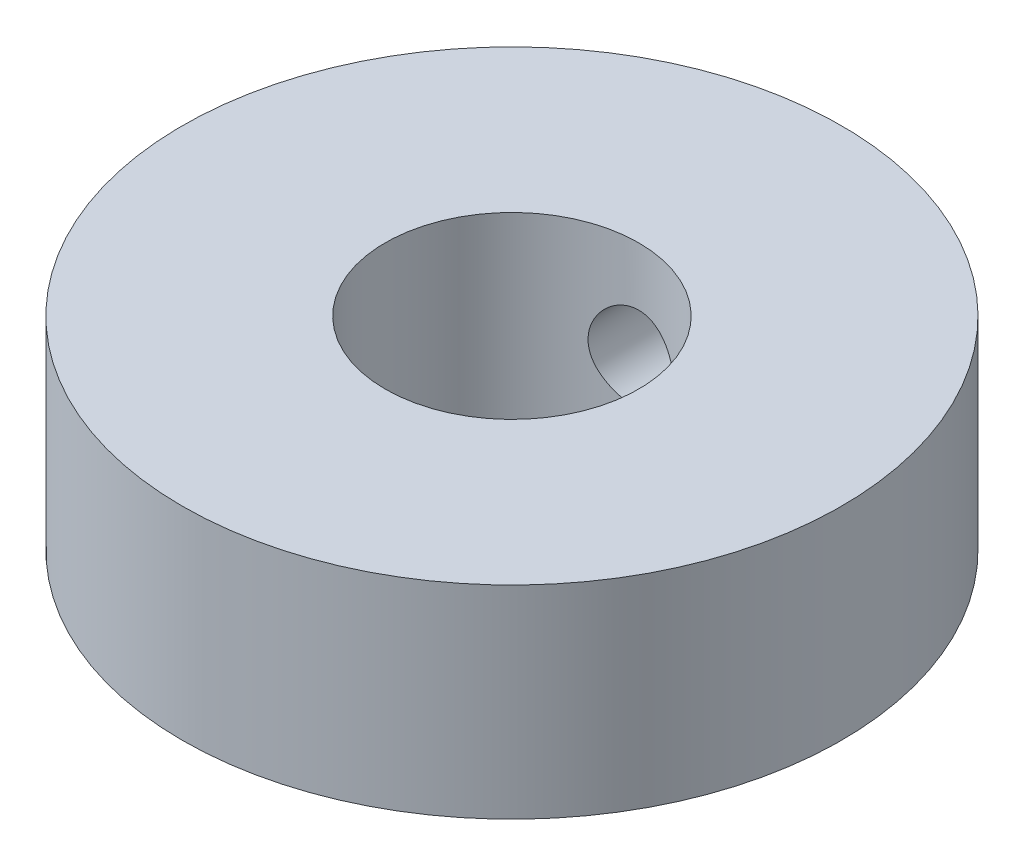
from build123d import *

# Parameters (mm, degrees)
SKETCH1_R           = 6.5
BOSS_EXTRUDE1_DEPTH = 4
SKETCH2_R           = 2.5
CUT_EXTRUDE1_DEPTH  = 11.024968828
SKETCH3_R           = 0.85
CUT_EXTRUDE2_DEPTH  = 11.024968828


with BuildPart() as part:
    # Sketch1 → Boss-Extrude1 (new body)
    with BuildSketch(Plane(origin=(0, 0, 0), x_dir=(1, 0, 0), z_dir=(0, 1, 0))):
        with Locations(Location((0, 0, 0), (0, 0, 270))):
            Circle(SKETCH1_R)
    extrude(amount=BOSS_EXTRUDE1_DEPTH)

    # Sketch2 → Cut-Extrude1 (cut, through all)
    with BuildSketch(Plane(origin=(0, 4, 0), x_dir=(1, 0, 0), z_dir=(0, 1, 0))):
        with Locations(Location((0, 0, 0), (0, 0, 270))):
            Circle(SKETCH2_R)
    extrude(amount=-CUT_EXTRUDE1_DEPTH, mode=Mode.SUBTRACT)

    # Sketch3 → Cut-Extrude2 (cut, through all)
    with BuildSketch(Plane.XY):
        with Locations((0, 2)):
            Circle(SKETCH3_R)
    extrude(amount=-CUT_EXTRUDE2_DEPTH, mode=Mode.SUBTRACT)


solid = part.part
